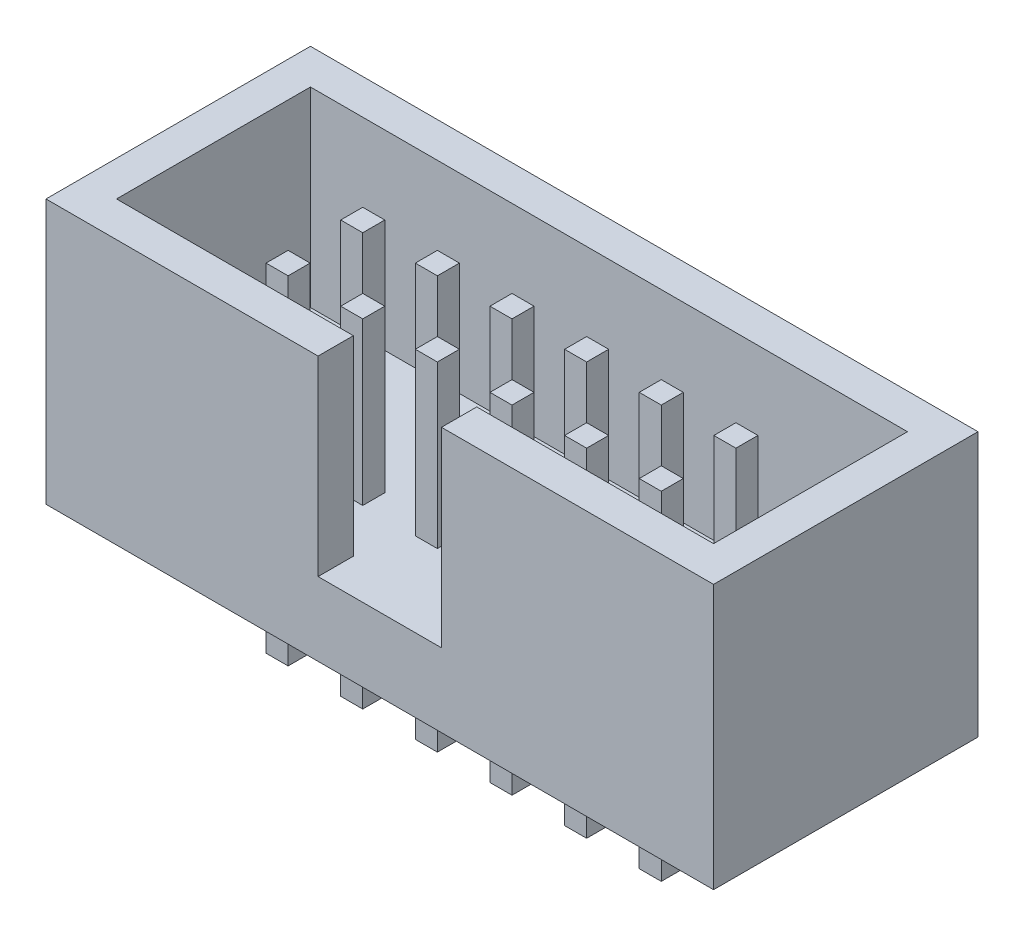
from build123d import *

# Parameters (mm, degrees)
SKETCH_1_W           = 22.72
SKETCH_1_H           = 9
EXTRUDE_1_DEPTH      = 9
SKETCH_2_W           = 20.32
SKETCH_2_H           = 6.6
CUT_EXTRUDE_1_DEPTH  = 6.5
SKETCH_3_W           = 4.2
SKETCH_3_H           = 6.5
CUT_EXTRUDE_2_DEPTH  = 6.5
EXTRUDE_2_DEPTH      = 3.5
EXTRUDE_2_DEPTH_BACK = 8
SKETCH_5_W           = 0.75
SKETCH_5_H           = 0.75


with BuildPart() as part:
    # 草图1 → 拉伸1 (new body)
    with BuildSketch(Plane(origin=(0, 0, 0), x_dir=(1, 0, 0), z_dir=(0, 1, 0))):
        Rectangle(SKETCH_1_W, SKETCH_1_H)
    extrude(amount=EXTRUDE_1_DEPTH)

    # 草图2 → 切除-拉伸1 (cut)
    with BuildSketch(Plane(origin=(0, 9, 0), x_dir=(-1, 0, 0), z_dir=(0, 1, 0))):
        Rectangle(SKETCH_2_W, SKETCH_2_H)
    extrude(amount=-CUT_EXTRUDE_1_DEPTH, mode=Mode.SUBTRACT)

    # 草图3 → 切除-拉伸2 (cut)
    with BuildSketch(Plane.XY.offset(4.5)):
        with Locations((0, 5.75)):
            Rectangle(SKETCH_3_W, SKETCH_3_H)
    extrude(amount=-CUT_EXTRUDE_2_DEPTH, mode=Mode.SUBTRACT)

    # 草图5 → 拉伸2 (add, two sides: drawn at the far end of the back side and taken through both)
    with BuildSketch(Plane.XZ.offset(-EXTRUDE_2_DEPTH_BACK)):
        with Locations((-1.27, 1.27)):
            Rectangle(SKETCH_5_W, SKETCH_5_H)
        with Locations((-3.81, 1.27)):
            Rectangle(SKETCH_5_W, SKETCH_5_H)
        with Locations((-6.35, 1.27)):
            Rectangle(SKETCH_5_W, SKETCH_5_H)
        with Locations((-6.35, -1.27)):
            Rectangle(SKETCH_5_W, SKETCH_5_H)
        with Locations((-3.81, -1.27)):
            Rectangle(SKETCH_5_W, SKETCH_5_H)
        with Locations((-1.27, -1.27)):
            Rectangle(SKETCH_5_W, SKETCH_5_H)
        with Locations((1.27, -1.27)):
            Rectangle(SKETCH_5_W, SKETCH_5_H)
        with Locations((3.81, -1.27)):
            Rectangle(SKETCH_5_W, SKETCH_5_H)
        with Locations((6.35, -1.27)):
            Rectangle(SKETCH_5_W, SKETCH_5_H)
        with Locations((6.35, 1.27)):
            Rectangle(SKETCH_5_W, SKETCH_5_H)
        with Locations((3.81, 1.27)):
            Rectangle(SKETCH_5_W, SKETCH_5_H)
        with Locations((1.27, 1.27)):
            Rectangle(SKETCH_5_W, SKETCH_5_H)
    extrude(amount=EXTRUDE_2_DEPTH + EXTRUDE_2_DEPTH_BACK)


solid = part.part
